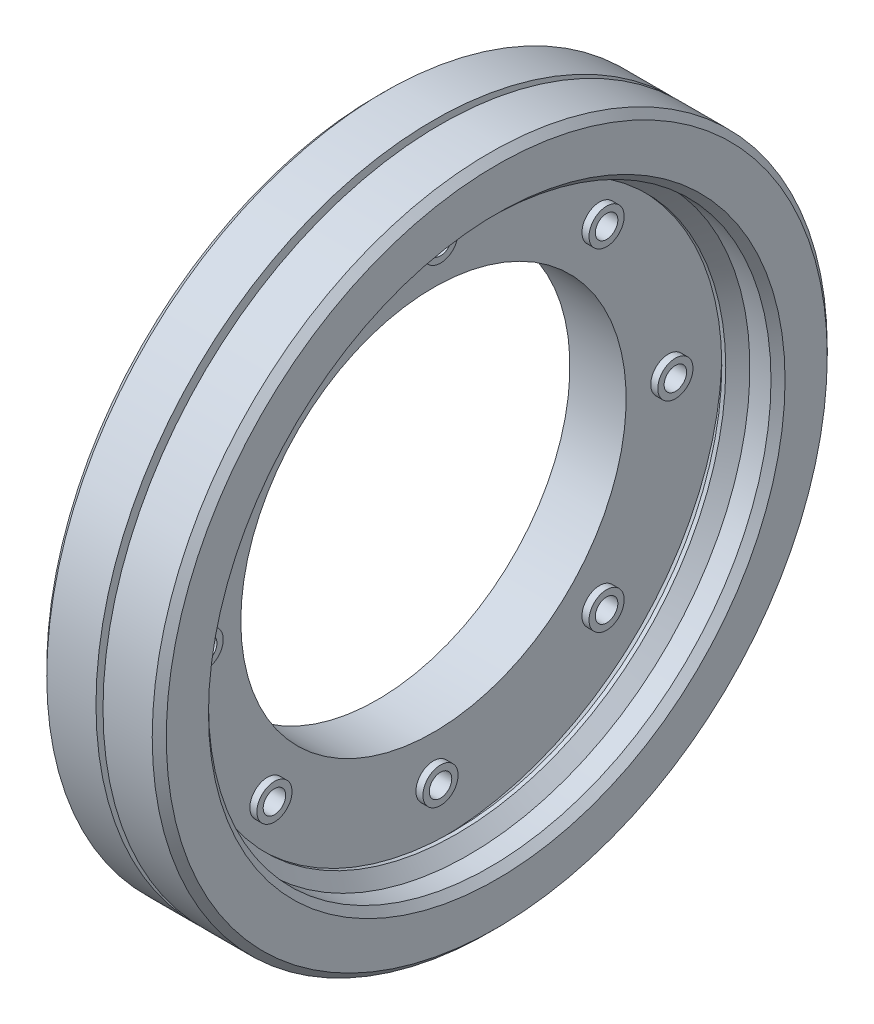
from build123d import *

# Parameters (mm, degrees)
SKETCH1_4_W         = 8
SKETCH1_4_H         = 20.6
SKETCH2_R           = 1.6
CUT_EXTRUDE1_DEPTH  = 10
SKETCH2_3_R         = 2.5
SKETCH2_3_R_2       = 1.6
BOSS_EXTRUDE1_DEPTH = 1
CIRPATTERN4_COUNT   = 8
CHAMFER4_SIZE       = 0.4
CHAMFER5_SIZE       = 1
CHAMFER6_SIZE       = 1


with BuildPart() as part:
    # Sketch1 → Revolve1 (revolve)
    with BuildSketch(Plane(origin=(0, 0, 0), x_dir=(1, 0, 0), z_dir=(0, 1, 0)), mode=Mode.PRIVATE) as revolve1_sk:
        Polygon((2, 38), (4, 40), (8, 40), (8, 48), (0, 48), (0, 40), align=None)
    revolve(revolve1_sk.sketch.rotate(Axis((0, 0, 0), (1, 0, 0)), 180), axis=Axis((0, 0, 0), (1, 0, 0)))

    # Chamfer4
    chamfer4_edges = [part.edges().sort_by_distance(p)[0] for p in [
        (2, 0, -38),
    ]]
    chamfer(chamfer4_edges, length=CHAMFER4_SIZE)

    # Chamfer5
    chamfer5_edges = [part.edges().sort_by_distance(p)[0] for p in [
        (8, 0, -40),
        (8, 0, -48),
    ]]
    chamfer(chamfer5_edges, length=CHAMFER5_SIZE)


with BuildPart() as body_2:
    # Sketch1<4> → Revolve2 (revolve)
    with BuildSketch(Plane(origin=(0, 0, 0), x_dir=(1, 0, 0), z_dir=(0, 1, 0)), mode=Mode.PRIVATE) as revolve2_sk:
        with Locations((-5, 37.7)):
            Rectangle(SKETCH1_4_W, SKETCH1_4_H)
    revolve(revolve2_sk.sketch.rotate(Axis((0, 0, 0), (1, 0, 0)), 180), axis=Axis((0, 0, 0), (1, 0, 0)))

    # Sketch2 → Cut-Extrude1 (cut)
    with BuildSketch(Plane(origin=(-1, 0, 0), x_dir=(0, 0, -1), z_dir=(1, 0, 0))):
        with Locations((33.4, 0)):
            Circle(SKETCH2_R)
    cut_extrude1 = extrude(amount=-CUT_EXTRUDE1_DEPTH, mode=Mode.SUBTRACT)

    # Sketch2<3> → Boss-Extrude1 (add)
    with BuildSketch(Plane(origin=(-1, 0, 0), x_dir=(0, 0, -1), z_dir=(1, 0, 0))):
        with Locations((33.4, 0)):
            Circle(SKETCH2_3_R)
        with Locations((33.4, 0)):
            Circle(SKETCH2_3_R_2, mode=Mode.SUBTRACT)
    boss_extrude1 = extrude(amount=BOSS_EXTRUDE1_DEPTH)

    # CirPattern4: Cut-Extrude1, Boss-Extrude1 ×8 about axis
    cirpattern4_axis = Axis((0, 0, 0), (1, 0, 0))
    add([cut_extrude1.rotate(cirpattern4_axis, i * 360 / CIRPATTERN4_COUNT) for i in range(1, CIRPATTERN4_COUNT)], mode=Mode.SUBTRACT)
    add([boss_extrude1.rotate(cirpattern4_axis, i * 360 / CIRPATTERN4_COUNT) for i in range(1, CIRPATTERN4_COUNT)])

    # Chamfer6
    chamfer6_edges = [body_2.edges().sort_by_distance(p)[0] for p in [
        (-9, 0, -48),
    ]]
    chamfer(chamfer6_edges, length=CHAMFER6_SIZE)


solid = Compound([part.part, body_2.part])
